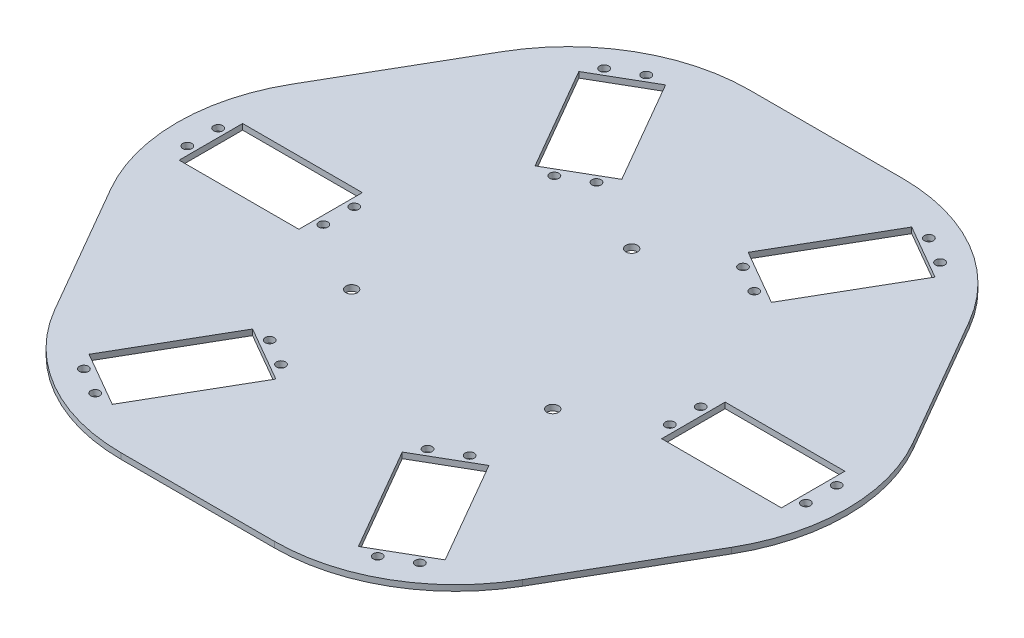
from build123d import *

# Parameters (mm, degrees)
SKETCH1_R           = 2.5
SKETCH1_W           = 66
SKETCH1_H           = 35
BOSS_EXTRUDE1_DEPTH = 3.175
SKETCH2_R           = 3.2
CUT_EXTRUDE1_DEPTH  = 3.175


with BuildPart() as part:
    # Sketch1 → Boss-Extrude1 (new body)
    with BuildSketch(Plane(origin=(0, 0, 0), x_dir=(1, 0, 0), z_dir=(0, 1, 0))):
        with BuildLine():
            Line((171.132486541, 50), (128.867513459, 123.205080757))
            ThreePointArc((128.867513459, 123.205080757), (92.264973081, 159.807621135), (42.264973081, 173.205080757))
            Line((42.264973081, 173.205080757), (-42.264973081, 173.205080757))
            ThreePointArc((-42.264973081, 173.205080757), (-92.264973081, 159.807621135), (-128.867513459, 123.205080757))
            Line((-128.867513459, 123.205080757), (-171.132486541, 50))
            ThreePointArc((-171.132486541, 50), (-184.529946162, 0), (-171.132486541, -50))
            Line((-171.132486541, -50), (-128.867513459, -123.205080757))
            ThreePointArc((-128.867513459, -123.205080757), (-92.264973081, -159.807621135), (-42.264973081, -173.205080757))
            Line((-42.264973081, -173.205080757), (42.264973081, -173.205080757))
            ThreePointArc((42.264973081, -173.205080757), (92.264973081, -159.807621135), (128.867513459, -123.205080757))
            Line((128.867513459, -123.205080757), (171.132486541, -50))
            ThreePointArc((171.132486541, -50), (184.529946162, 0), (171.132486541, 50))
        make_face()
        with Locations(Location((170.5, 8.5, 0), (0, 0, 270))):
            Circle(SKETCH1_R, mode=Mode.SUBTRACT)
        with Locations(Location((170.5, -8.5, 0), (0, 0, 270))):
            Circle(SKETCH1_R, mode=Mode.SUBTRACT)
        with Locations(Location((95.5, 8.5, 0), (0, 0, 270))):
            Circle(SKETCH1_R, mode=Mode.SUBTRACT)
        with Locations(Location((95.5, -8.5, 0), (0, 0, 270))):
            Circle(SKETCH1_R, mode=Mode.SUBTRACT)
        with Locations(Location((40.388784068, -86.955426061, 0), (0, 0, 270))):
            Circle(SKETCH1_R, mode=Mode.SUBTRACT)
        with Locations(Location((55.111215932, -78.455426061, 0), (0, 0, 270))):
            Circle(SKETCH1_R, mode=Mode.SUBTRACT)
        with Locations(Location((92.611215932, -143.407331345, 0), (0, 0, 270))):
            Circle(SKETCH1_R, mode=Mode.SUBTRACT)
        with Locations(Location((77.888784068, -151.907331345, 0), (0, 0, 270))):
            Circle(SKETCH1_R, mode=Mode.SUBTRACT)
        with Locations(Location((-55.111215932, -78.455426061, 0), (0, 0, 270))):
            Circle(SKETCH1_R, mode=Mode.SUBTRACT)
        with Locations(Location((-40.388784068, -86.955426061, 0), (0, 0, 270))):
            Circle(SKETCH1_R, mode=Mode.SUBTRACT)
        with Locations(Location((-77.888784068, -151.907331345, 0), (0, 0, 270))):
            Circle(SKETCH1_R, mode=Mode.SUBTRACT)
        with Locations(Location((-92.611215932, -143.407331345, 0), (0, 0, 270))):
            Circle(SKETCH1_R, mode=Mode.SUBTRACT)
        with Locations(Location((-95.5, 8.5, 0), (0, 0, 270))):
            Circle(SKETCH1_R, mode=Mode.SUBTRACT)
        with Locations(Location((-95.5, -8.5, 0), (0, 0, 270))):
            Circle(SKETCH1_R, mode=Mode.SUBTRACT)
        with Locations(Location((-170.5, -8.5, 0), (0, 0, 270))):
            Circle(SKETCH1_R, mode=Mode.SUBTRACT)
        with Locations(Location((-170.5, 8.5, 0), (0, 0, 270))):
            Circle(SKETCH1_R, mode=Mode.SUBTRACT)
        with Locations(Location((-40.388784068, 86.955426061, 0), (0, 0, 270))):
            Circle(SKETCH1_R, mode=Mode.SUBTRACT)
        with Locations(Location((-55.111215932, 78.455426061, 0), (0, 0, 270))):
            Circle(SKETCH1_R, mode=Mode.SUBTRACT)
        with Locations(Location((-92.611215932, 143.407331345, 0), (0, 0, 270))):
            Circle(SKETCH1_R, mode=Mode.SUBTRACT)
        with Locations(Location((-77.888784068, 151.907331345, 0), (0, 0, 270))):
            Circle(SKETCH1_R, mode=Mode.SUBTRACT)
        with Locations(Location((55.111215932, 78.455426061, 0), (0, 0, 270))):
            Circle(SKETCH1_R, mode=Mode.SUBTRACT)
        with Locations(Location((40.388784068, 86.955426061, 0), (0, 0, 270))):
            Circle(SKETCH1_R, mode=Mode.SUBTRACT)
        with Locations(Location((77.888784068, 151.907331345, 0), (0, 0, 270))):
            Circle(SKETCH1_R, mode=Mode.SUBTRACT)
        with Locations(Location((92.611215932, 143.407331345, 0), (0, 0, 270))):
            Circle(SKETCH1_R, mode=Mode.SUBTRACT)
        with Locations((133, 0)):
            Rectangle(SKETCH1_W, SKETCH1_H, mode=Mode.SUBTRACT)
        Polygon((65.155444566, -77.852540378), (98.155444566, -135.010217028), (67.844555434, -152.510217028), (34.844555434, -95.352540378), align=None, mode=Mode.SUBTRACT)
        Polygon((-34.844555434, -95.352540378), (-67.844555434, -152.510217028), (-98.155444566, -135.010217028), (-65.155444566, -77.852540378), align=None, mode=Mode.SUBTRACT)
        with Locations((-133, 0)):
            Rectangle(SKETCH1_W, SKETCH1_H, mode=Mode.SUBTRACT)
        Polygon((-65.155444566, 77.852540378), (-98.155444566, 135.010217028), (-67.844555434, 152.510217028), (-34.844555434, 95.352540378), align=None, mode=Mode.SUBTRACT)
        Polygon((34.844555434, 95.352540378), (67.844555434, 152.510217028), (98.155444566, 135.010217028), (65.155444566, 77.852540378), align=None, mode=Mode.SUBTRACT)
    extrude(amount=BOSS_EXTRUDE1_DEPTH)

    # Sketch2 → Cut-Extrude1 (cut)
    with BuildSketch(Plane(origin=(0, 3.175, 0), x_dir=(1, 0, 0), z_dir=(0, 1, 0))):
        with Locations(Location((55.794244464, -33.346698257, 0), (0, 0, 270))):
            Circle(SKETCH2_R)
        with Locations(Location((-56.776210055, -31.645883963, 0), (0, 0, 270))):
            Circle(SKETCH2_R)
        with Locations(Location((0.981965591, 64.99258222, 0), (0, 0, 270))):
            Circle(SKETCH2_R)
    extrude(amount=-CUT_EXTRUDE1_DEPTH, mode=Mode.SUBTRACT)


solid = part.part
